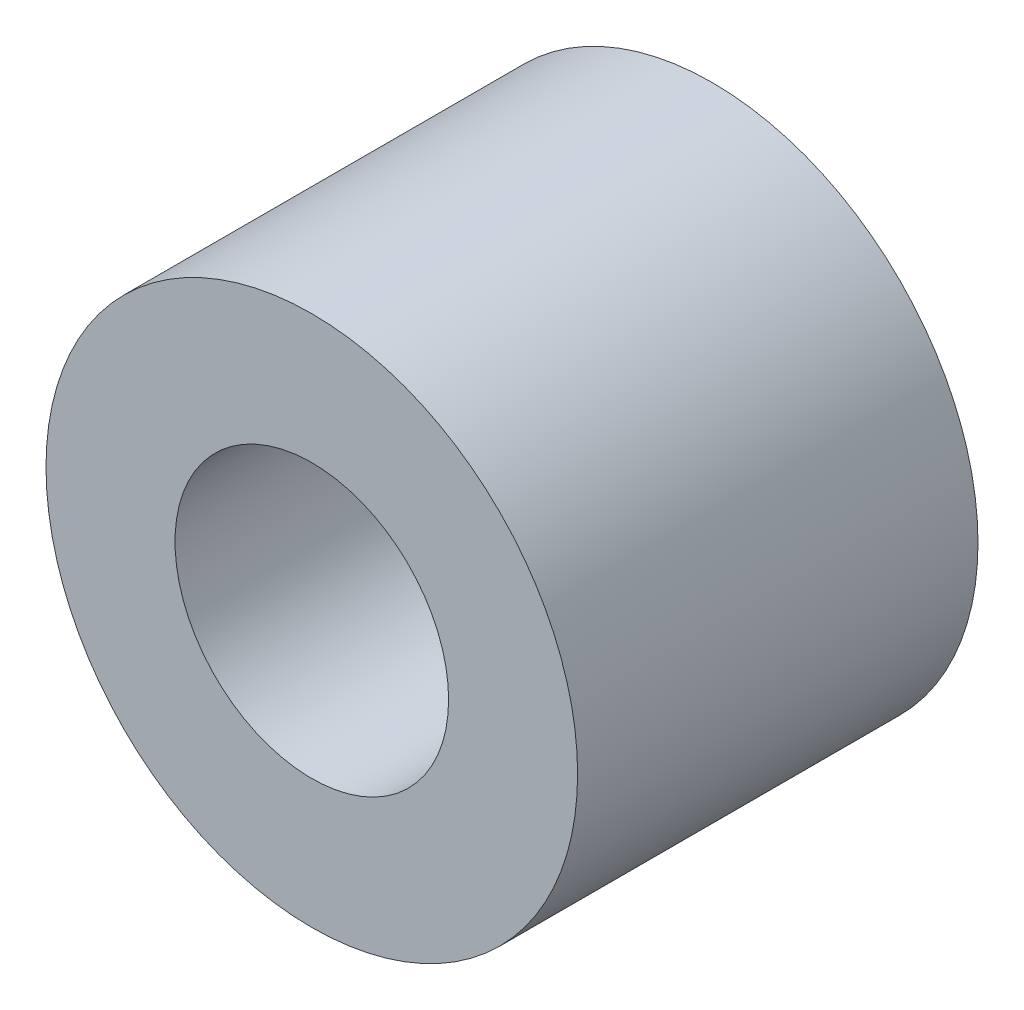
from build123d import *

# Parameters (mm, degrees)
SKETCH1_R           = 11.95
SKETCH1_R_2         = 6.15
BOSS_EXTRUDE1_DEPTH = 18


with BuildPart() as part:
    # Sketch1 → Boss-Extrude1 (new body)
    with BuildSketch(Plane.XY):
        Circle(SKETCH1_R)
        Circle(SKETCH1_R_2, mode=Mode.SUBTRACT)
    extrude(amount=BOSS_EXTRUDE1_DEPTH)


solid = part.part
